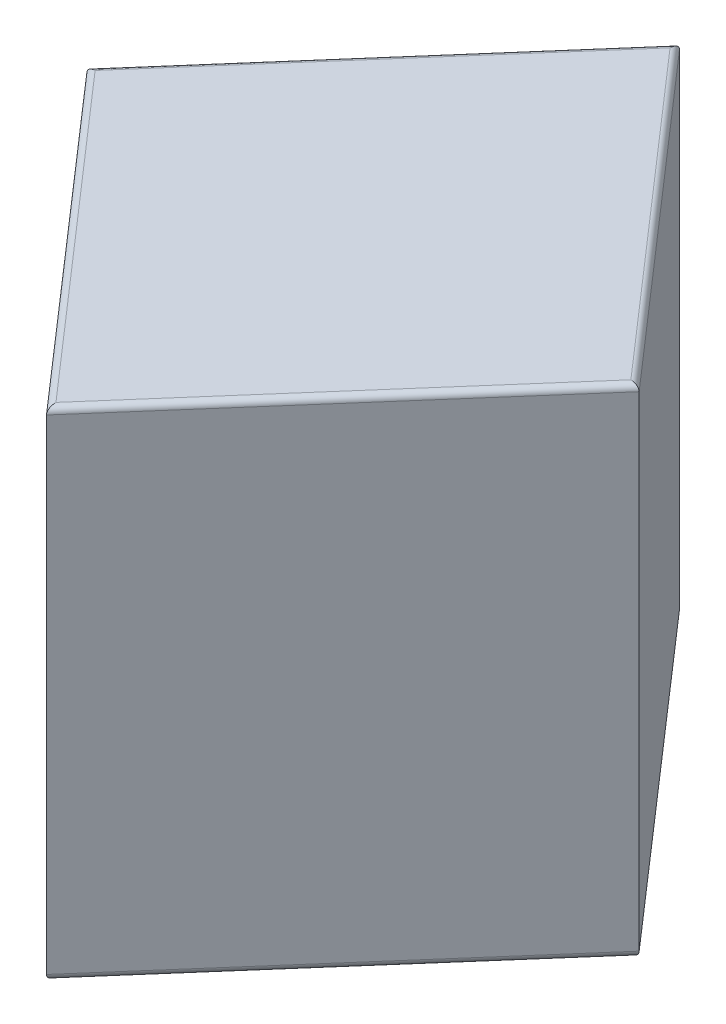
from build123d import *

# Parameters (mm, degrees)
BOSS_EXTRUDE1_DEPTH = 40
FILLET1_R           = 0.5


with BuildPart() as part:
    # Sketch1 → Boss-Extrude1 (new body)
    with BuildSketch(Plane(origin=(0, 0, 0), x_dir=(-1, 0, 0), z_dir=(0, 1, 0))):
        Polygon((22.228552834, -5.26e-07), (0, -25.478873765), (-22.228552834, -5.26e-07), (0, 25.478872714), align=None)
    extrude(amount=BOSS_EXTRUDE1_DEPTH)

    # Fillet1
    fillet1_edges = [part.edges().sort_by_distance(p)[0] for p in [
        (11.114276417, 40, -12.739437146),
        (-11.114276417, 40, -12.739437146),
        (-11.114276417, 40, 12.739436094),
        (-11.114276417, 0, -12.739437146),
        (11.114276417, 0, -12.739437146),
        (11.114276417, 0, 12.739436094),
        (-11.114276417, 0, 12.739436094),
        (11.114276417, 40, 12.739436094),
    ]]
    fillet(fillet1_edges, radius=FILLET1_R)


solid = part.part
